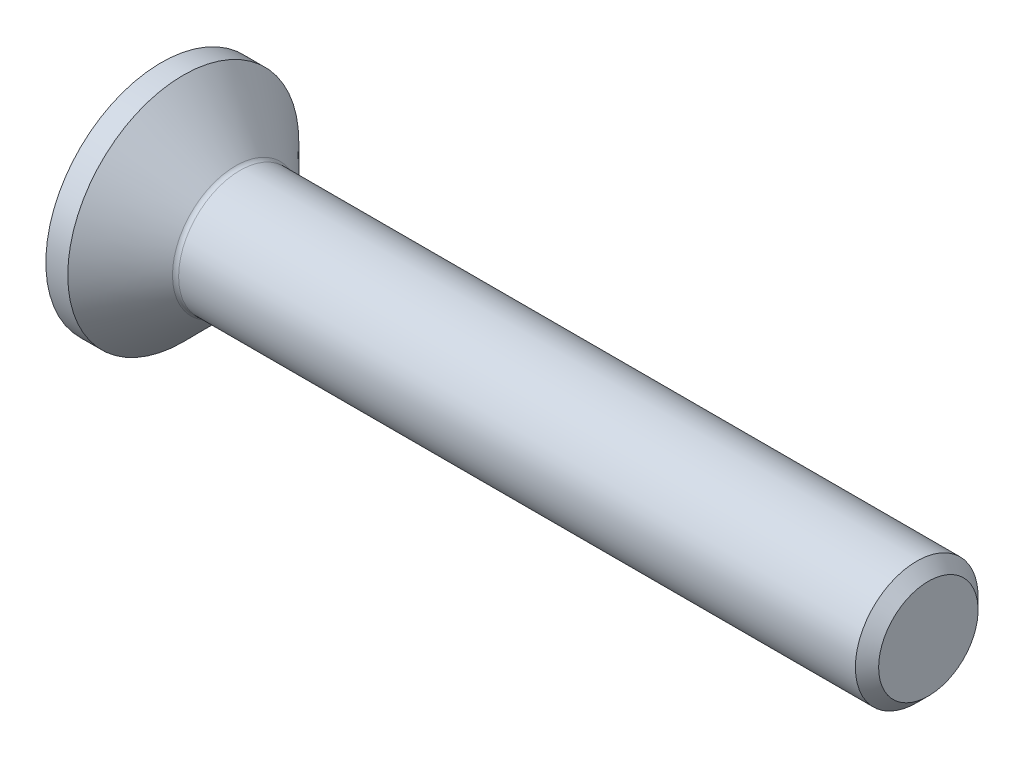
from build123d import *

# Parameters (mm, degrees)
HEXAGONSOCKET_DEPTH = 1.5
HEADFILLET_R        = 0.2
CHAMFER_2_SIZE      = 0.379
SKETCH4_W           = 5
SKETCH4_H           = 5


with BuildPart() as part:
    # Sketch1 → Base (revolve)
    with BuildSketch(Plane.XY, mode=Mode.PRIVATE) as base_sk:
        Polygon((0, 0), (0, 4.48), (2.48, 2), (25, 2), (25, 0), align=None)
    revolve(base_sk.sketch.rotate(Axis((-0.587069181, 0, 0), (1, 0, 0)), 90), axis=Axis((-0.587069181, 0, 0), (1, 0, 0)))

    # Sketch2 → HexagonSocket (cut)
    with BuildSketch(Plane(origin=(0, 0, 0), x_dir=(0, 0, -1), z_dir=(1, 0, 0))):
        Polygon((1.443375673, 0), (0.721687836, 1.25), (-0.721687836, 1.25), (-1.443375673, 0), (-0.721687836, -1.25), (0.721687836, -1.25), align=None)
    extrude(amount=HEXAGONSOCKET_DEPTH, mode=Mode.SUBTRACT)

    # Sketch3 → Cut-Revolve1 (revolve, cut)
    with BuildSketch(Plane.XY, mode=Mode.PRIVATE) as cut_revolve1_sk:
        Polygon((1.5, 1.25), (2.221687836, 0), (1.5, 0), align=None)
    revolve(cut_revolve1_sk.sketch.rotate(Axis((-0.439109555, 0, 0), (1, 0, 0)), 90), axis=Axis((-0.439109555, 0, 0), (1, 0, 0)), mode=Mode.SUBTRACT)

    # HeadFillet
    headfillet_edges = [part.edges().sort_by_distance(p)[0] for p in [
        (2.48, 0, -2),
    ]]
    fillet(headfillet_edges, radius=HEADFILLET_R)

    # Chamfer 2
    chamfer_2_edges = [part.edges().sort_by_distance(p)[0] for p in [
        (25, 0, -2),
    ]]
    chamfer(chamfer_2_edges, length=CHAMFER_2_SIZE)

    # Sketch4 → Cut-Revolve2 (revolve, cut)
    with BuildSketch(Plane(origin=(0, 0, 0), x_dir=(1, 0, 0), z_dir=(0, 1, 0)), mode=Mode.PRIVATE) as cut_revolve2_sk:
        with Locations((0.5, 6.265)):
            Rectangle(SKETCH4_W, SKETCH4_H)
    revolve(cut_revolve2_sk.sketch.rotate(Axis((11.853138686, 0, 0), (-1, 0, 0)), 180), axis=Axis((11.853138686, 0, 0), (-1, 0, 0)), mode=Mode.SUBTRACT)


solid = part.part
